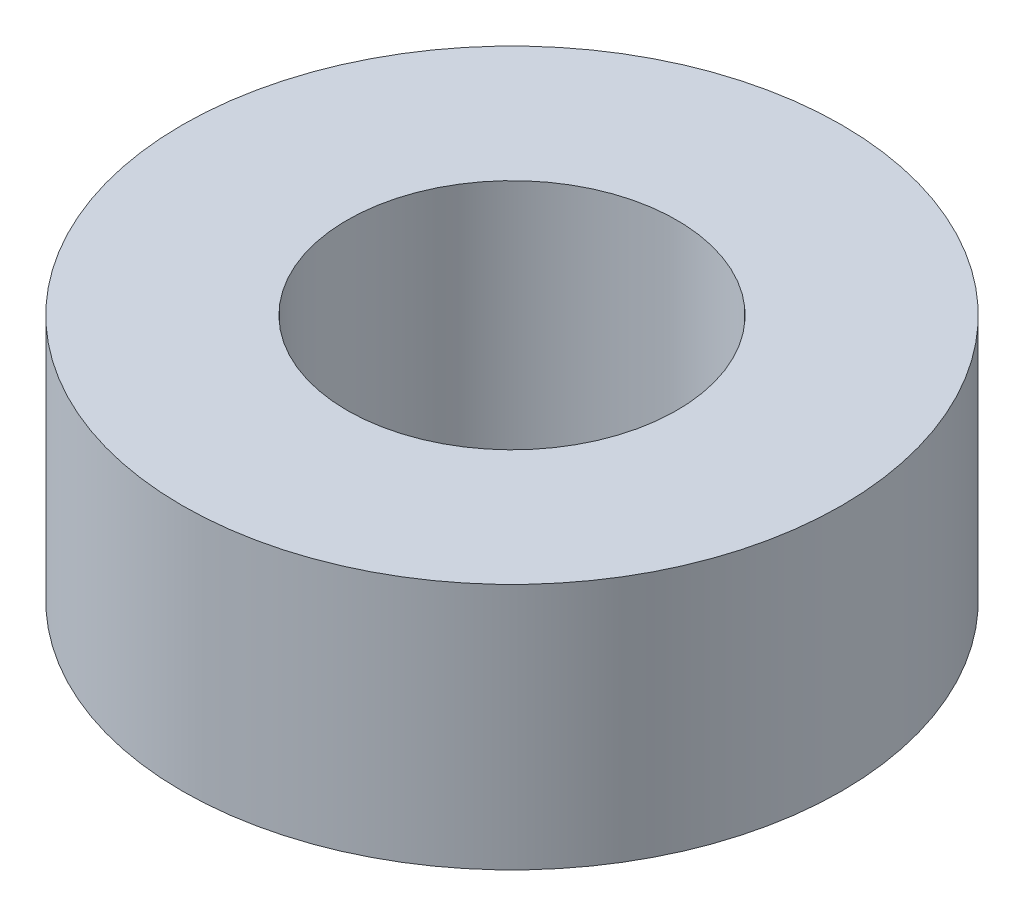
from build123d import *

# Parameters (mm, degrees)
ESQUISSE1_R        = 4
ESQUISSE1_R_2      = 2
BOSS_EXTRU_1_DEPTH = 3


with BuildPart() as part:
    # Esquisse1 → Boss.-Extru.1 (new body)
    with BuildSketch(Plane(origin=(0, 0, 0), x_dir=(1, 0, 0), z_dir=(0, 1, 0))):
        with Locations(Location((0, 0, 0), (0, 0, 270))):
            Circle(ESQUISSE1_R)
        with Locations(Location((0, 0, 0), (0, 0, 270))):
            Circle(ESQUISSE1_R_2, mode=Mode.SUBTRACT)
    extrude(amount=BOSS_EXTRU_1_DEPTH)


solid = part.part
